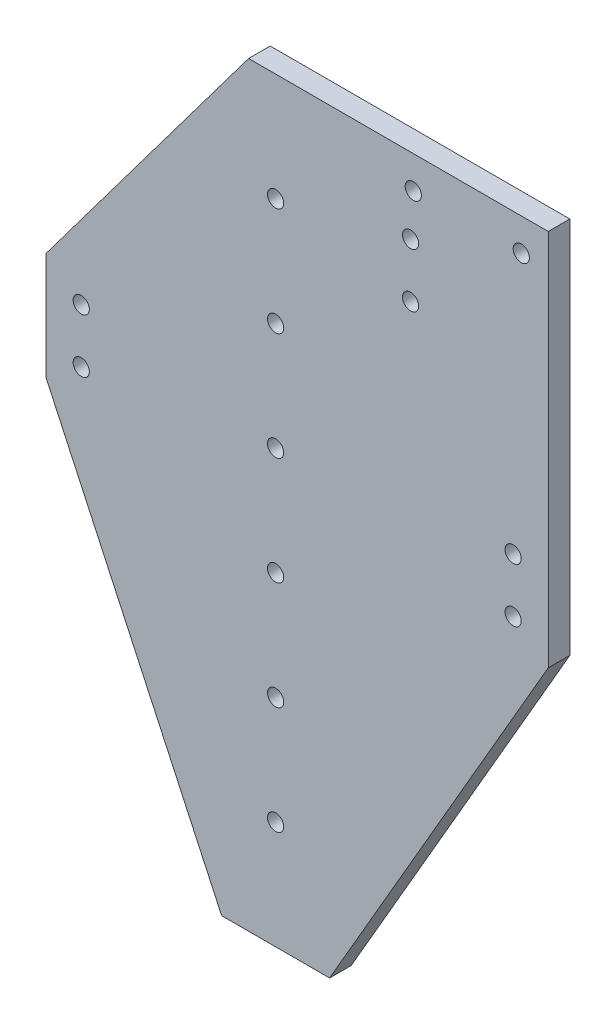
from build123d import *

# Parameters (mm, degrees)
SKETCH_1_R      = 1.5
EXTRUDE_1_DEPTH = 4


with BuildPart() as part:
    # 草图1 → 凸台-拉伸1 (new body)
    with BuildSketch(Plane.XY):
        Polygon((0, 0), (0, 70), (-55.5, 70), (-93, 20), (-93, 0), (-60.5, -70), (-40.5, -70), align=None)
        with Locations((-86.5, 15)):
            Circle(SKETCH_1_R, mode=Mode.SUBTRACT)
        with Locations(Location((-86.5, 5, 0), (0, 0, 180))):
            Circle(SKETCH_1_R, mode=Mode.SUBTRACT)
        with Locations((-6.5, 5)):
            Circle(SKETCH_1_R, mode=Mode.SUBTRACT)
        with Locations(Location((-6.5, 15, 0), (0, 0, 180))):
            Circle(SKETCH_1_R, mode=Mode.SUBTRACT)
        with Locations((-25.5, 56)):
            Circle(SKETCH_1_R, mode=Mode.SUBTRACT)
        with Locations((-25.5, 46)):
            Circle(SKETCH_1_R, mode=Mode.SUBTRACT)
        with Locations((-50.5, 10)):
            Circle(SKETCH_1_R, mode=Mode.SUBTRACT)
        with Locations((-50.5, 30)):
            Circle(SKETCH_1_R, mode=Mode.SUBTRACT)
        with Locations((-50.5, 50)):
            Circle(SKETCH_1_R, mode=Mode.SUBTRACT)
        with Locations((-50.5, -10)):
            Circle(SKETCH_1_R, mode=Mode.SUBTRACT)
        with Locations((-50.5, -30)):
            Circle(SKETCH_1_R, mode=Mode.SUBTRACT)
        with Locations((-5, 64)):
            Circle(SKETCH_1_R, mode=Mode.SUBTRACT)
        with Locations((-25, 64)):
            Circle(SKETCH_1_R, mode=Mode.SUBTRACT)
        with Locations((-50.5, -50)):
            Circle(SKETCH_1_R, mode=Mode.SUBTRACT)
    extrude(amount=EXTRUDE_1_DEPTH)


solid = part.part
